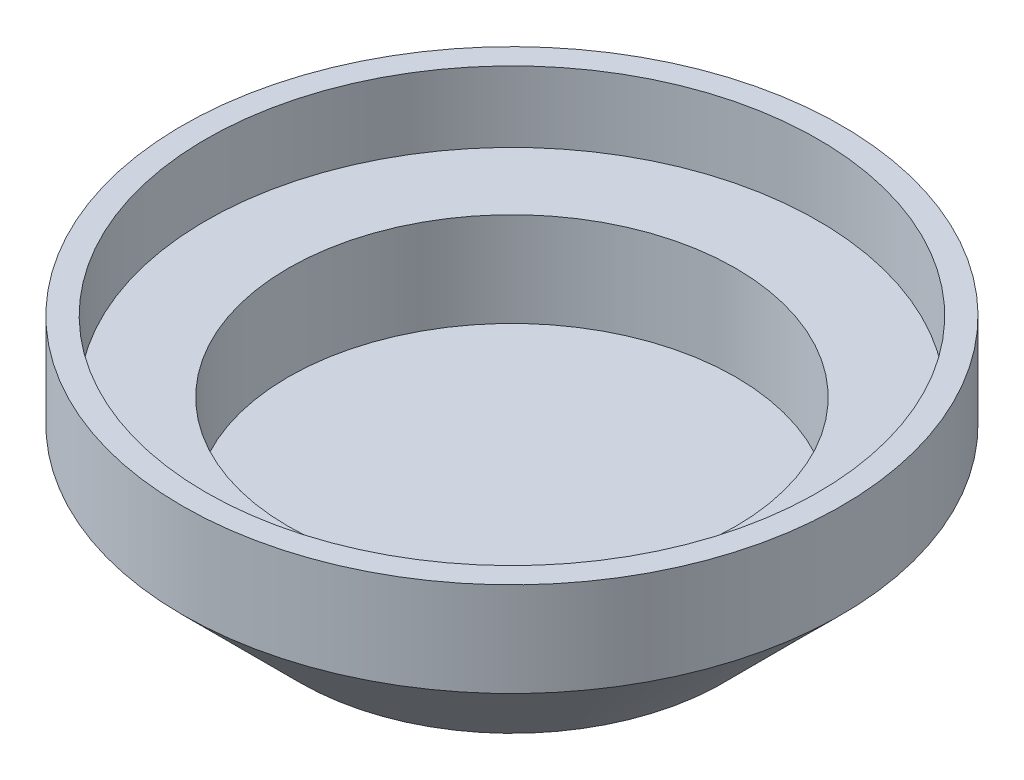
from build123d import *

# Parameters (mm, degrees)
ESQUISSE1_R             = 14
BOSS_EXTRU_1_DEPTH      = 9
ESQUISSE2_R             = 13
ENL_V_MAT_EXTRU_1_DEPTH = 3
ESQUISSE4_R             = 9.5
ENL_V_MAT_EXTRU_2_DEPTH = 4
CHANFREIN1_SIZE         = 5


with BuildPart() as part:
    # Esquisse1 → Boss.-Extru.1 (new body)
    with BuildSketch(Plane(origin=(0, 0, 0), x_dir=(1, 0, 0), z_dir=(0, 1, 0))):
        with Locations(Location((0, 0, 0), (0, 0, 270))):
            Circle(ESQUISSE1_R)
    extrude(amount=BOSS_EXTRU_1_DEPTH)

    # Esquisse2 → Enlèv. mat.-Extru.1 (cut)
    with BuildSketch(Plane(origin=(0, 9, 0), x_dir=(1, 0, 0), z_dir=(0, 1, 0))):
        with Locations(Location((0, 0, 0), (0, 0, 270))):
            Circle(ESQUISSE2_R)
    extrude(amount=-ENL_V_MAT_EXTRU_1_DEPTH, mode=Mode.SUBTRACT)

    # Esquisse4 → Enlèv. mat.-Extru.2 (cut)
    with BuildSketch(Plane(origin=(0, 6, 0), x_dir=(1, 0, 0), z_dir=(0, 1, 0))):
        with Locations(Location((0, 0, 0), (0, 0, 270))):
            Circle(ESQUISSE4_R)
    extrude(amount=-ENL_V_MAT_EXTRU_2_DEPTH, mode=Mode.SUBTRACT)

    # Chanfrein1
    chanfrein1_edges = [part.edges().sort_by_distance(p)[0] for p in [
        (0, 0, -14),
    ]]
    chamfer(chanfrein1_edges, length=CHANFREIN1_SIZE)


solid = part.part
